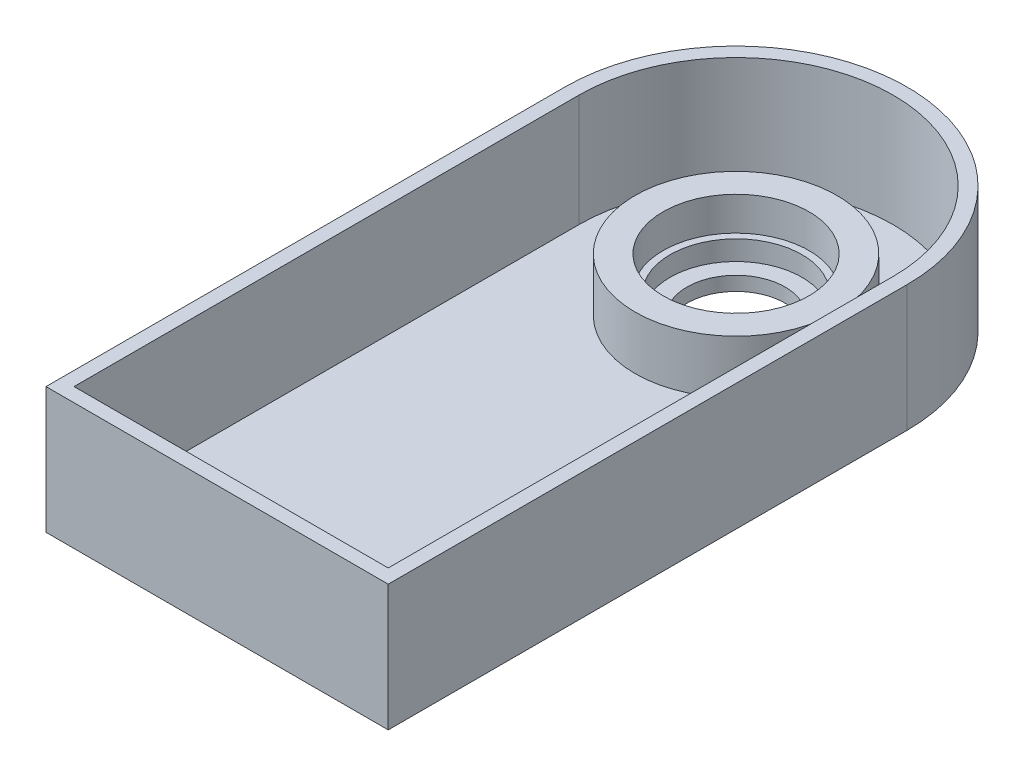
from build123d import *

# Parameters (mm, degrees)
BOSS_EXTRUDE2_DEPTH = 5
BOSS_EXTRUDE3_DEPTH = 40
SKETCH4_R           = 17.5
CUT_EXTRUDE1_DEPTH  = 40
SKETCH5_R           = 26
SKETCH5_R_2         = 23.5
BOSS_EXTRUDE4_DEPTH = 7
SKETCH6_R           = 36
SKETCH6_R_2         = 26
BOSS_EXTRUDE5_DEPTH = 19


with BuildPart() as part:
    # Sketch1 → Boss-Extrude2 (new body)
    with BuildSketch(Plane(origin=(0, 0, 0), x_dir=(1, 0, 0), z_dir=(0, 1, 0))):
        with BuildLine():
            Line((122, -183), (0, -183))
            Line((0, -183), (0, 2))
            ThreePointArc((0, 2), (61, 63), (122, 2))
            Line((122, 2), (122, -183))
        make_face()
    extrude(amount=BOSS_EXTRUDE2_DEPTH)

    # Sketch3 → Boss-Extrude3 (add)
    with BuildSketch(Plane(origin=(0, 5, 0), x_dir=(1, 0, 0), z_dir=(0, 1, 0))):
        with BuildLine():
            Line((122, -183), (122, 2))
            ThreePointArc((122, 2), (61, 63), (0, 2))
            Line((0, 2), (0, -183))
            Line((0, -183), (122, -183))
        make_face()
        with BuildLine():
            Line((5, -178), (5, 2))
            ThreePointArc((5, 2), (61, 58), (117, 2))
            Line((117, 2), (117, -178))
            Line((117, -178), (5, -178))
        make_face(mode=Mode.SUBTRACT)
    extrude(amount=BOSS_EXTRUDE3_DEPTH)

    # Sketch4 → Cut-Extrude1 (cut)
    with BuildSketch(Plane(origin=(0, 5, 0), x_dir=(1, 0, 0), z_dir=(0, 1, 0))):
        with Locations(Location((61, 2, 0), (0, 0, 270))):
            Circle(SKETCH4_R)
    extrude(amount=-CUT_EXTRUDE1_DEPTH, mode=Mode.SUBTRACT)

    # Sketch5 → Boss-Extrude4 (add)
    with BuildSketch(Plane(origin=(0, 5, 0), x_dir=(1, 0, 0), z_dir=(0, 1, 0))):
        with Locations(Location((61, 2, 0), (0, 0, 270))):
            Circle(SKETCH5_R)
        with Locations(Location((61, 2, 0), (0, 0, 270))):
            Circle(SKETCH5_R_2, mode=Mode.SUBTRACT)
    extrude(amount=BOSS_EXTRUDE4_DEPTH)

    # Sketch6 → Boss-Extrude5 (add)
    with BuildSketch(Plane(origin=(0, 5, 0), x_dir=(1, 0, 0), z_dir=(0, 1, 0))):
        with Locations(Location((61, 2, 0), (0, 0, 270))):
            Circle(SKETCH6_R)
        with Locations(Location((61, 2, 0), (0, 0, 270))):
            Circle(SKETCH6_R_2, mode=Mode.SUBTRACT)
    extrude(amount=BOSS_EXTRUDE5_DEPTH)


solid = part.part
